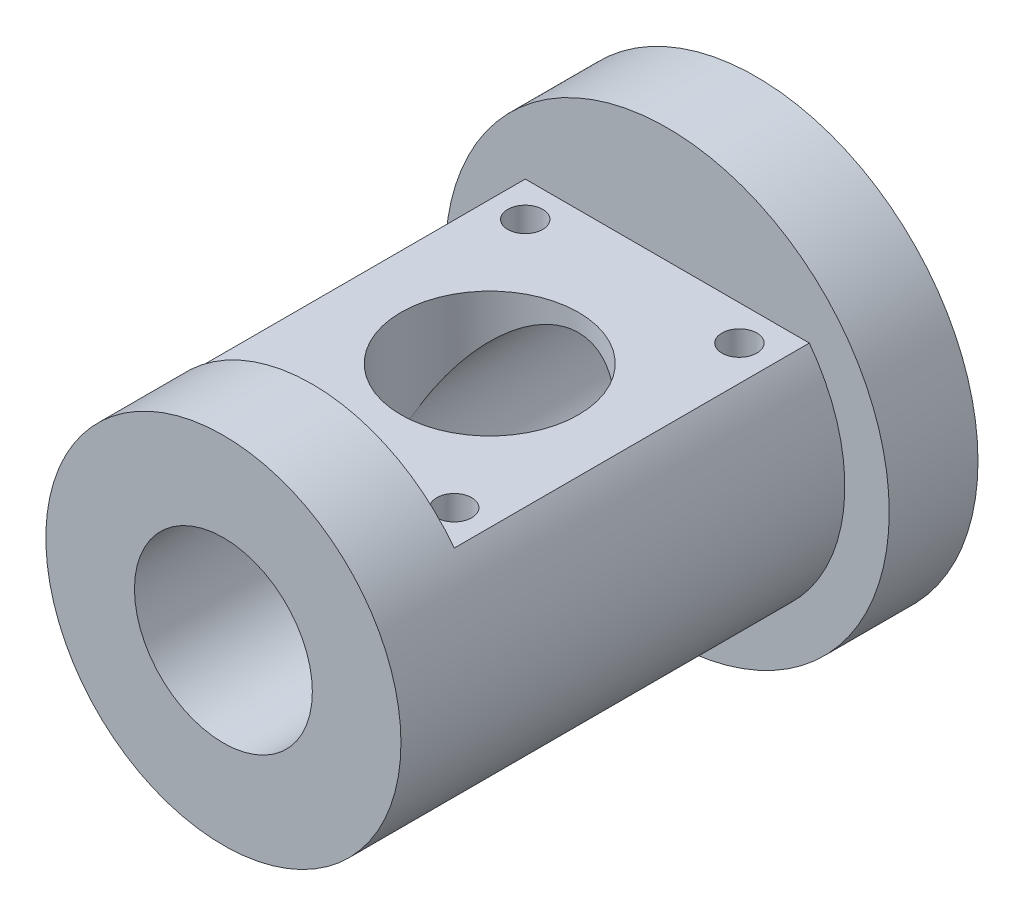
from build123d import *

# Parameters (mm, degrees)
SKETCH1_R               = 25.4
SKETCH1_R_2             = 12.7254
BOSS_EXTRUDE1_DEPTH     = 76.2
SKETCH3_R               = 31.75
SKETCH3_R_2             = 12.7254
BOSS_EXTRUDE2_DEPTH     = 12.7
CUT_EXTRUDE3_REACH      = 90.445
CUT_EXTRUDE3_END_RADIUS = 25.4
SKETCH2_R               = 12.7
SKETCH5_W               = 50.8
SKETCH5_H               = 50.8
CUT_EXTRUDE4_DEPTH      = 10.16
SKETCH7_R               = 2.665
CUT_EXTRUDE6_DEPTH      = 6.35
SKETCH8_R               = 2.5
CUT_EXTRUDE7_DEPTH      = 6.35


with BuildPart() as part:
    # Sketch1 → Boss-Extrude1 (new body)
    with BuildSketch(Plane.XY):
        with Locations(Location((0, 0, 0), (0, 0, 180))):
            Circle(SKETCH1_R)
        with Locations(Location((0, 0, 0), (0, 0, 180))):
            Circle(SKETCH1_R_2, mode=Mode.SUBTRACT)
    extrude(amount=BOSS_EXTRUDE1_DEPTH)

    # Sketch3 → Boss-Extrude2 (add)
    with BuildSketch(Plane(origin=(0, 0, 0), x_dir=(-1, 0, 0), z_dir=(0, 0, -1))):
        Circle(SKETCH3_R)
        Circle(SKETCH3_R_2, mode=Mode.SUBTRACT)
    extrude(amount=-BOSS_EXTRUDE2_DEPTH)

    # Cut-Extrude3: up to this cylinder (the profile starts inside it)
    cut_extrude3_end = Plane(origin=(0, 0, 38.1), z_dir=(0, 0, -1)) * Cylinder(CUT_EXTRUDE3_END_RADIUS, 232.69, mode=Mode.PRIVATE)
    # Sketch2 → Cut-Extrude3 (cut, up to the surface)
    with BuildSketch(Plane(origin=(0, 0, 0), x_dir=(1, 0, 0), z_dir=(0, 1, 0)), mode=Mode.PRIVATE) as cut_extrude3_sk1:
        with Locations(Location((0, -38.1, 0), (0, 0, 90))):
            Circle(SKETCH2_R)
    cut_extrude3_tool1 = extrude(cut_extrude3_sk1.sketch, amount=CUT_EXTRUDE3_REACH, mode=Mode.PRIVATE) & cut_extrude3_end
    add(cut_extrude3_tool1.solids().sort_by_distance((0, 0, 38.1))[0], mode=Mode.SUBTRACT)

    # Sketch5 → Cut-Extrude4 (cut)
    with BuildSketch(Plane(origin=(0, 25.4, 0), x_dir=(1, 0, 0), z_dir=(0, 1, 0))):
        with Locations((0, -38.1)):
            Rectangle(SKETCH5_W, SKETCH5_H)
    extrude(amount=-CUT_EXTRUDE4_DEPTH, mode=Mode.SUBTRACT)

    # Sketch7 → Cut-Extrude6 (cut)
    with BuildSketch(Plane(origin=(0, 0, 0), x_dir=(-1, 0, 0), z_dir=(0, 0, -1))):
        with Locations((0, 25.4)):
            Circle(SKETCH7_R)
        with Locations((21.997045256, 12.7)):
            Circle(SKETCH7_R)
        with Locations((21.997045256, -12.7)):
            Circle(SKETCH7_R)
        with Locations((0, -25.4)):
            Circle(SKETCH7_R)
        with Locations((-21.997045256, -12.7)):
            Circle(SKETCH7_R)
        with Locations((-21.997045256, 12.7)):
            Circle(SKETCH7_R)
    extrude(amount=-CUT_EXTRUDE6_DEPTH, mode=Mode.SUBTRACT)

    # Sketch8 → Cut-Extrude7 (cut)
    with BuildSketch(Plane(origin=(0, 15.24, 0), x_dir=(1, 0, 0), z_dir=(0, 1, 0))):
        with Locations(Location((-15.32, -17.7, 0), (0, 0, 270))):
            Circle(SKETCH8_R)
        with Locations(Location((15.32, -17.7, 0), (0, 0, 90))):
            Circle(SKETCH8_R)
        with Locations(Location((-15.32, -58.5, 0), (0, 0, 90))):
            Circle(SKETCH8_R)
        with Locations(Location((15.32, -58.5, 0), (0, 0, 270))):
            Circle(SKETCH8_R)
    extrude(amount=-CUT_EXTRUDE7_DEPTH, mode=Mode.SUBTRACT)


solid = part.part
